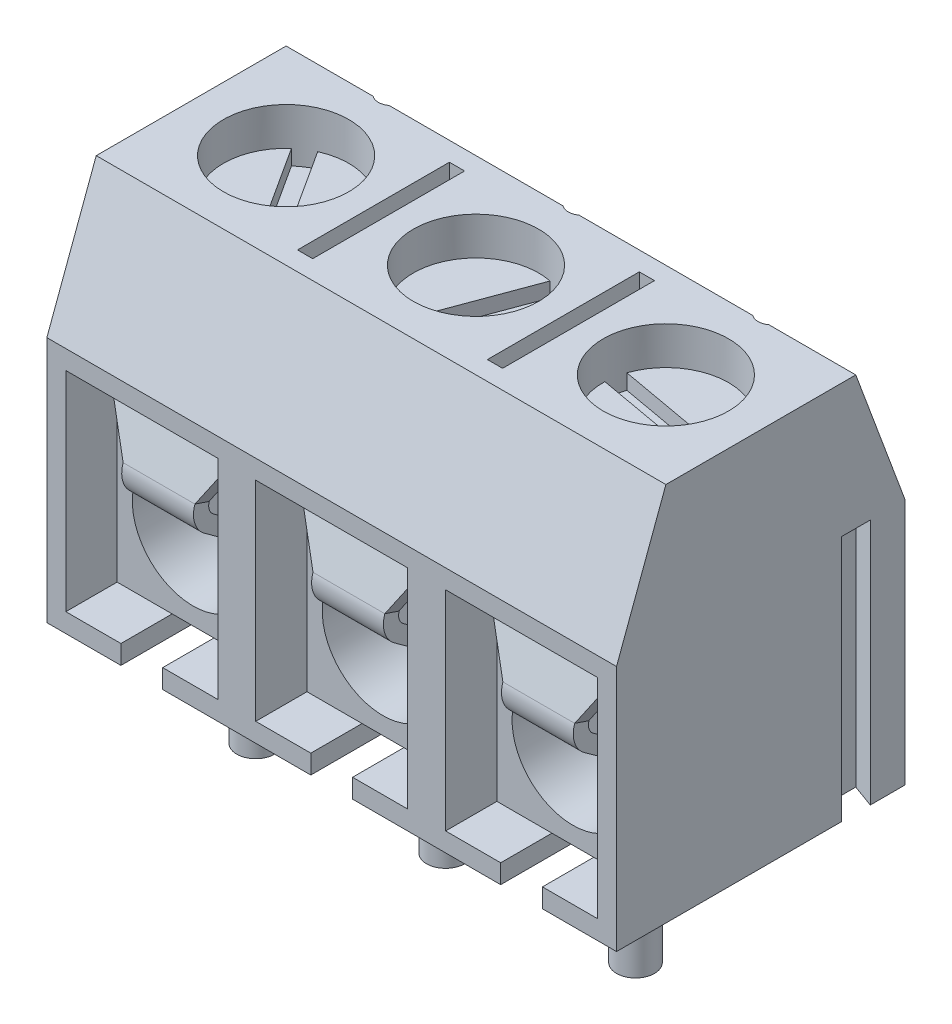
from build123d import *
from build123d.topology import SkipClean

# Parameters (mm, degrees)
SKETCH1_W               = 15
SKETCH1_H               = 7.6
EXTRUDE1_DEPTH          = 10
CUT_EXTRUDE1_DEPTH      = 15.643770006
CUT_EXTRUDE1_DEPTH_BACK = 15.643770006
SKETCH2_OUTSIDE_W       = 13.512
SKETCH2_OUTSIDE_H       = 15.912
SKETCH3_R               = 1.65
SKETCH3_R_2             = 0.35
SKETCH3_W               = 0.4
SKETCH3_H               = 4
CUT_EXTRUDE2_DEPTH      = 4
SKETCH4_W               = 4
SKETCH4_H               = 5.5
CUT_EXTRUDE3_DEPTH      = 5.6
EXTRUDE3_DEPTH          = 6.5
CUT_EXTRUDE5_DEPTH      = 6.5
SKETCH10_W              = 1.1
SKETCH10_H              = 0.5
CUT_EXTRUDE6_DEPTH      = 3.6
SKETCH5_W               = 4
SKETCH5_H               = 5.1
EXTRUDE2_DEPTH          = 4.25
SKETCH6_R               = 1.6
CUT_EXTRUDE4_DEPTH      = 4.25
SKETCH11_R              = 0.5
EXTRUDE4_DEPTH          = 3.5
EXTRUDE5_START          = -3
SKETCH12_R              = 1.65
EXTRUDE5_DEPTH          = 3
CUT_EXTRUDE7_DEPTH      = 0.4
EXTRUDE6_DEPTH          = 0.945
EXTRUDE9_DEPTH          = 0.39
LPATTERN1_COUNT         = 3
LPATTERN1_PITCH         = 5
FILLET1_R               = 0.3
FILLET2_R               = 0.7


with BuildPart() as part:
    # Sketch1 → Extrude1 (new body)
    with BuildSketch(Plane(origin=(0, 0, 0), x_dir=(1, 0, 0), z_dir=(0, 1, 0))):
        with Locations((2.5, 0)):
            Rectangle(SKETCH1_W, SKETCH1_H)
    extrude(amount=EXTRUDE1_DEPTH)

    # Sketch2 outside → Cut-Extrude1 (cut, two sides: drawn at the far end of the back side and taken through both)
    with BuildSketch(Plane(origin=(0, 0, 0), x_dir=(0, 0, -1), z_dir=(1, 0, 0)).offset(-CUT_EXTRUDE1_DEPTH_BACK)):
        with Locations((0, 5)):
            Rectangle(SKETCH2_OUTSIDE_W, SKETCH2_OUTSIDE_H)
        Polygon((2.5, 10), (3.8, 6.5), (3.8, 0), (-3.8, 0), (-3.8, 6.5), (-2.5, 10), align=None, mode=Mode.SUBTRACT)
    extrude(amount=CUT_EXTRUDE1_DEPTH + CUT_EXTRUDE1_DEPTH_BACK, mode=Mode.SUBTRACT)

    # Sketch3 → Cut-Extrude2 (cut)
    with BuildSketch(Plane(origin=(0, 10, 0), x_dir=(-1, 0, 0), z_dir=(0, 1, 0))):
        with Locations(Location((2.5, 0, 0), (0, 0, 90))):
            Circle(SKETCH3_R)
        with Locations(Location((-2.5, 0, 0), (0, 0, 90))):
            Circle(SKETCH3_R)
        with Locations(Location((2.5, -2.78, 0), (0, 0, 90))):
            Circle(SKETCH3_R_2)
        with Locations(Location((-2.5, -2.78, 0), (0, 0, 90))):
            Circle(SKETCH3_R_2)
        with Locations(Location((-7.5, 0, 0), (0, 0, 90))):
            Circle(SKETCH3_R)
        with Locations(Location((-7.5, -2.78, 0), (0, 0, 90))):
            Circle(SKETCH3_R_2)
        Rectangle(SKETCH3_W, SKETCH3_H)
        with Locations((-5, 0)):
            Rectangle(SKETCH3_W, SKETCH3_H)
    extrude(amount=-CUT_EXTRUDE2_DEPTH, mode=Mode.SUBTRACT)

    # Sketch4 → Cut-Extrude3 (cut)
    with BuildSketch(Plane.XY.offset(3.8)):
        with Locations((-2.5, 3.25)):
            Rectangle(SKETCH4_W, SKETCH4_H)
        with Locations((2.5, 3.25)):
            Rectangle(SKETCH4_W, SKETCH4_H)
        with Locations((7.5, 3.25)):
            Rectangle(SKETCH4_W, SKETCH4_H)
    extrude(amount=-CUT_EXTRUDE3_DEPTH, mode=Mode.SUBTRACT)

    # Sketch7 → Extrude3 (add)
    with BuildSketch(Plane(origin=(0, 0, 0), x_dir=(1, 0, 0), z_dir=(0, 1, 0))):
        Polygon((-5.6, 3.1), (-5, 2.881617859), (-5, 2.118382141), (-5.6, 1.9), align=None)
    extrude(amount=EXTRUDE3_DEPTH)

    # Sketch9 → Cut-Extrude5 (cut)
    with BuildSketch(Plane(origin=(0, 0, 0), x_dir=(1, 0, 0), z_dir=(0, 1, 0))):
        Polygon((10, 2.881617859), (9.4, 3.1), (9.4, 1.9), (10, 2.118382141), align=None)
    extrude(amount=CUT_EXTRUDE5_DEPTH, mode=Mode.SUBTRACT)

    # Sketch10 → Cut-Extrude6 (cut)
    with BuildSketch(Plane.XY.offset(3.8)):
        with Locations((-2.5, 0.25)):
            Rectangle(SKETCH10_W, SKETCH10_H)
        with Locations((2.5, 0.25)):
            Rectangle(SKETCH10_W, SKETCH10_H)
        with Locations((7.5, 0.25)):
            Rectangle(SKETCH10_W, SKETCH10_H)
    extrude(amount=-CUT_EXTRUDE6_DEPTH, mode=Mode.SUBTRACT)

    # Sketch5 → Extrude2 (add)
    with BuildSketch(Plane.XY.offset(-1.8)):
        with Locations((-2.5, 3.05)):
            Rectangle(SKETCH5_W, SKETCH5_H)
        with Locations((2.5, 3.05)):
            Rectangle(SKETCH5_W, SKETCH5_H)
        with Locations((7.5, 3.05)):
            Rectangle(SKETCH5_W, SKETCH5_H)
    extrude(amount=EXTRUDE2_DEPTH)

    # Sketch6 → Cut-Extrude4 (cut)
    with BuildSketch(Plane.XY.offset(2.45)):
        with Locations((-2.5, 2.554263468)):
            Circle(SKETCH6_R)
        with Locations((2.5, 2.554263468)):
            Circle(SKETCH6_R)
        with Locations((7.5, 2.554263468)):
            Circle(SKETCH6_R)
    extrude(amount=-CUT_EXTRUDE4_DEPTH, mode=Mode.SUBTRACT)

    # Sketch11 → Extrude4 (add)
    with BuildSketch(Plane.XZ.offset(-0.5)):
        with Locations(Location((-2.5, 0.8, 0), (0, 0, 180))):
            Circle(SKETCH11_R)
        with Locations(Location((2.5, 0.8, 0), (0, 0, 90))):
            Circle(SKETCH11_R)
        with Locations(Location((7.5, 0.8, 0), (0, 0, 90))):
            Circle(SKETCH11_R)
    extrude(amount=EXTRUDE4_DEPTH)

    # Sketch12 → Extrude5 (add)
    with BuildSketch(Plane.XZ.offset(-6).offset(EXTRUDE5_START)):
        with Locations(Location((2.5, 0, 0), (0, 0, 90))):
            Circle(SKETCH12_R)
        with Locations(Location((-2.5, 0, 0), (0, 0, 90))):
            Circle(SKETCH12_R)
        with Locations(Location((7.5, 0, 0), (0, 0, 90))):
            Circle(SKETCH12_R)
    extrude(amount=EXTRUDE5_DEPTH)

    # Sketch13 → Cut-Extrude7 (cut)
    with SkipClean():  # the faces are left unmerged after this step: merging them gives an invalid solid
        with BuildSketch(Plane(origin=(0, 9, 0), x_dir=(-1, 0, 0), z_dir=(0, 1, 0))):
            with BuildLine():
                Line((3.594307251, -1.234905519), (1.825829895, 1.505986278))
                ThreePointArc((1.825829895, 1.505986278), (1.605433494, 1.386452583), (1.405692749, 1.234905519))
                Line((1.405692749, 1.234905519), (3.174170105, -1.505986278))
                ThreePointArc((3.174170105, -1.505986278), (3.394566506, -1.386452583), (3.594307251, -1.234905519))
            make_face()
            with BuildLine():
                Line((-5.938894906, -0.534276038), (-9.149461674, 0.042144841))
                ThreePointArc((-9.149461674, 0.042144841), (-9.12403295, 0.291576712), (-9.061105094, 0.534276038))
                Line((-9.061105094, 0.534276038), (-5.850538326, -0.042144841))
                ThreePointArc((-5.850538326, -0.042144841), (-5.87596705, -0.291576712), (-5.938894906, -0.534276038))
            make_face()
            with BuildLine():
                Line((-2.83217089, -1.616218581), (-1.698971441, 1.44251629))
                ThreePointArc((-1.698971441, 1.44251629), (-1.926782442, 1.54723031), (-2.16782911, 1.616218581))
                Line((-2.16782911, 1.616218581), (-3.301028559, -1.44251629))
                ThreePointArc((-3.301028559, -1.44251629), (-3.073217558, -1.54723031), (-2.83217089, -1.616218581))
            make_face()
        extrude(amount=-CUT_EXTRUDE7_DEPTH, mode=Mode.SUBTRACT)

    # Sketch14 → Extrude6 (add, symmetric)
    with SkipClean():  # the faces are left unmerged after this step: merging them gives an invalid solid
        with BuildSketch(Plane.ZY.offset(2.5)):
            Polygon((2.45, 5.6), (3.03887637, 3.861674443), (0.167170254, 1.787608865), (-0.546359637, 2.097431054), (-0.705673534, 1.730526322), (0.216750724, 1.33), (3.512480259, 3.710312924), (2.736824279, 6), (-1.8, 6), (-1.8, 5.6), align=None)
        extrude6 = extrude(amount=EXTRUDE6_DEPTH, both=True)

    # Sketch15 → Extrude9 (add)
    with SkipClean():  # the faces are left unmerged after this step: merging them gives an invalid solid
        with BuildSketch(Plane(origin=(0, 1.449355072, 4.278403908), x_dir=(1, 0, 0), z_dir=(0, 0.32085037888995993, 0.9471298930802308))):
            Polygon((-1.555, 4.8), (-1.555, 2.903968921), (-0.51, 4.8), align=None)
            Polygon((-3.445, 4.8), (-3.445, 2.903968921), (-4.49, 4.8), align=None)
        extrude9 = extrude(amount=-EXTRUDE9_DEPTH)

    # LPattern1: Extrude6, Extrude9 ×3
    with SkipClean():  # the faces are left unmerged after this step: merging them gives an invalid solid
        with Locations(*[(i * LPATTERN1_PITCH, 0, 0) for i in range(1, LPATTERN1_COUNT)]):
            add(extrude6)
            add(extrude9)

    # Fillet1
    fillet1_edges = [part.edges().sort_by_distance(p)[0] for p in [
        (-2.5, 3.861674443, 3.03887637),
        (-2.5, 1.787608865, 0.167170254),
        (2.5, 3.861674443, 3.03887637),
        (2.5, 1.787608865, 0.167170254),
        (7.5, 3.861674443, 3.03887637),
        (7.5, 1.787608865, 0.167170254),
    ]]
    fillet(fillet1_edges, radius=FILLET1_R)

    # Fillet2
    fillet2_edges = [part.edges().sort_by_distance(p)[0] for p in [
        (-2.5, 3.710312924, 3.512480259),
        (-2.5, 1.33, 0.216750724),
        (2.5, 1.33, 0.216750724),
        (2.5, 3.710312924, 3.512480259),
        (7.5, 3.710312924, 3.512480259),
        (7.5, 1.33, 0.216750724),
    ]]
    fillet(fillet2_edges, radius=FILLET2_R)


solid = part.part
